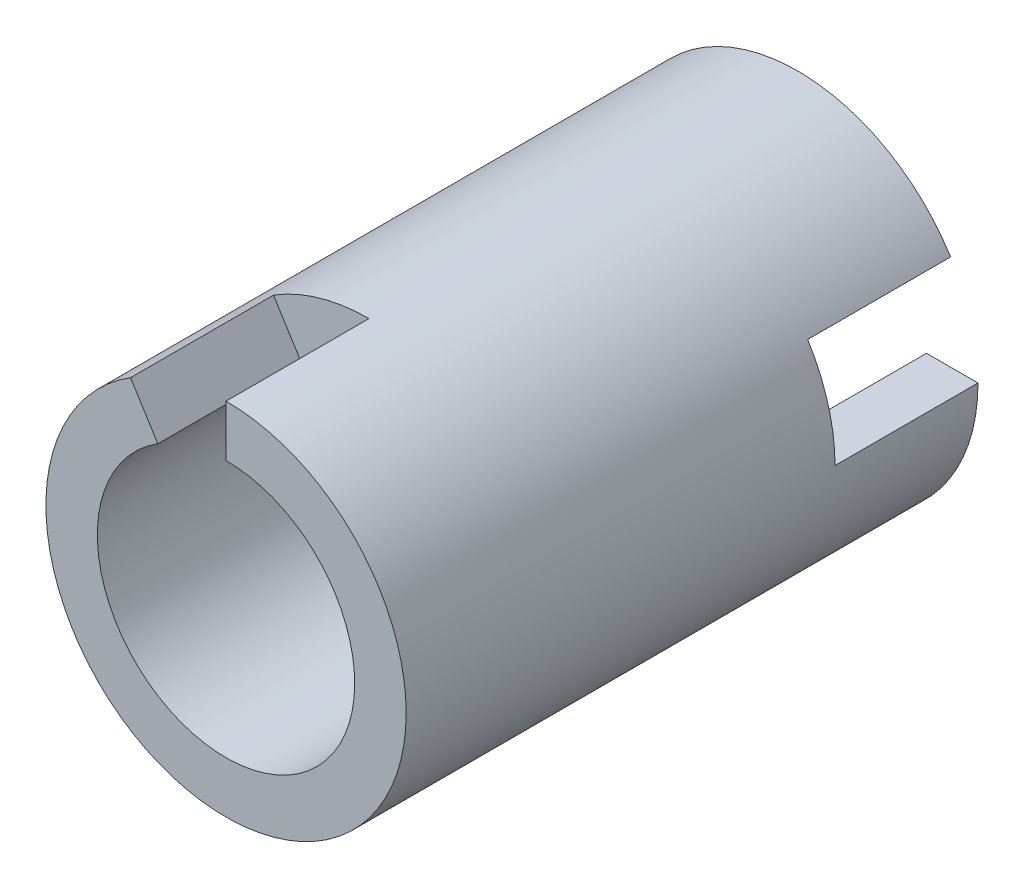
from build123d import *

# Parameters (mm, degrees)
BOSS_EXTRUDE1_DEPTH      = 10
BOSS_EXTRUDE1_DEPTH_BACK = 10
SKETCH1_R                = 6.5
SKETCH1_R_2              = 4.5
CUT_EXTRUDE2_DEPTH       = 5
SKETCH4_R                = 6.5
SKETCH4_R_2              = 6.3
CUT_EXTRUDE4_DEPTH       = 23.011360703
CUT_EXTRUDE3_DEPTH       = 5


with BuildPart() as part:
    # Sketch1 → Boss-Extrude1 (new, two sides: drawn at the far end of the back side and taken through both)
    with BuildSketch(Plane.XY.offset(-BOSS_EXTRUDE1_DEPTH_BACK)):
        Circle(SKETCH1_R)
        Circle(SKETCH1_R_2, mode=Mode.SUBTRACT)
    extrude(amount=BOSS_EXTRUDE1_DEPTH + BOSS_EXTRUDE1_DEPTH_BACK)

    # Sketch2 → Cut-Extrude2 (cut)
    with BuildSketch(Plane.XY.offset(10)):
        with BuildLine():
            Line((-6.230040483, 9.970148902), (0, 0))
            Line((0, 0), (0, 11.756584264))
            ThreePointArc((0, 11.756584264), (-3.2405538, 11.301154128), (-6.230040483, 9.970148902))
        make_face()
    extrude(amount=-CUT_EXTRUDE2_DEPTH, mode=Mode.SUBTRACT)

    # Sketch4 → Cut-Extrude4 (cut, through all)
    with BuildSketch(Plane.XY.offset(10)):
        Circle(SKETCH4_R)
        Circle(SKETCH4_R_2, mode=Mode.SUBTRACT)
    extrude(amount=-CUT_EXTRUDE4_DEPTH, mode=Mode.SUBTRACT)

    # Sketch3 → Cut-Extrude3 (cut)
    with BuildSketch(Plane.XY.offset(-10)):
        with BuildLine():
            Line((9.970148902, 6.230040483), (0, 0))
            Line((0, 0), (11.756584264, 0))
            ThreePointArc((11.756584264, 0), (11.301154128, 3.2405538), (9.970148902, 6.230040483))
        make_face()
    extrude(amount=CUT_EXTRUDE3_DEPTH, mode=Mode.SUBTRACT)


solid = part.part
